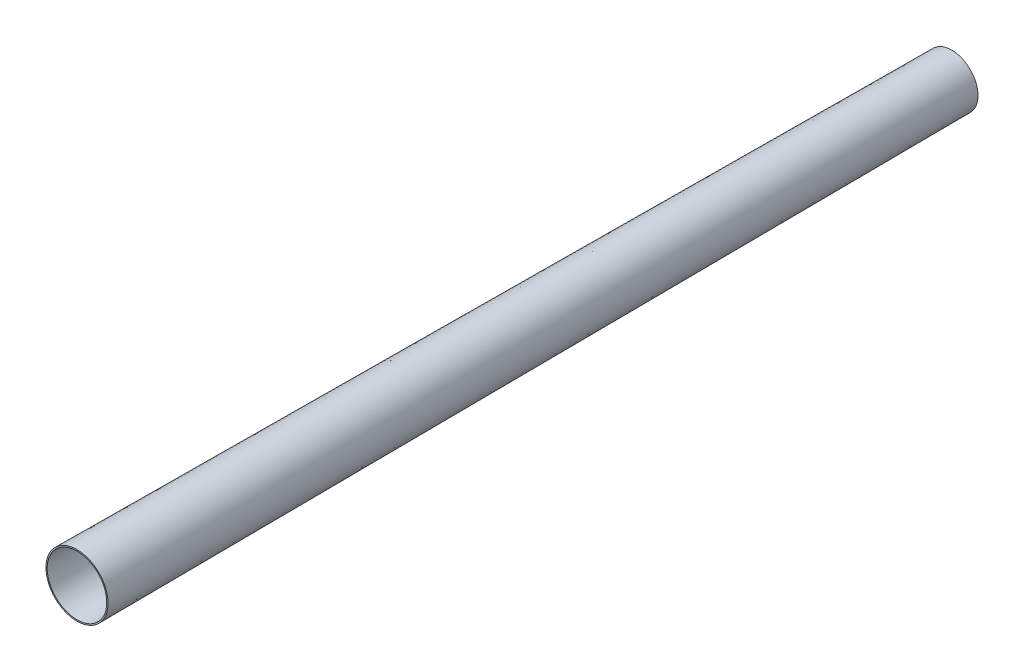
from build123d import *

# Parameters (mm, degrees)
SKETCH1_R = 10.492040521
SKETCH2_R = 12.404382882
SHELL1_T  = -0.5


with BuildPart() as part:
    # Sketch1 → Loft1 section 0
    with BuildSketch(Plane.XY):
        Circle(SKETCH1_R)
    # Sketch2 → Loft1 section 1
    with BuildSketch(Plane.XY.offset(349.70022741)):
        Circle(SKETCH2_R)
    loft()

    # Shell1
    shell1_openings = [part.faces().sort_by_distance(p)[0] for p in [
        (0, 0, 349.70022741),
        (0, 0, 0),
    ]]
    offset(amount=SHELL1_T, openings=shell1_openings, kind=Kind.INTERSECTION)


solid = part.part
